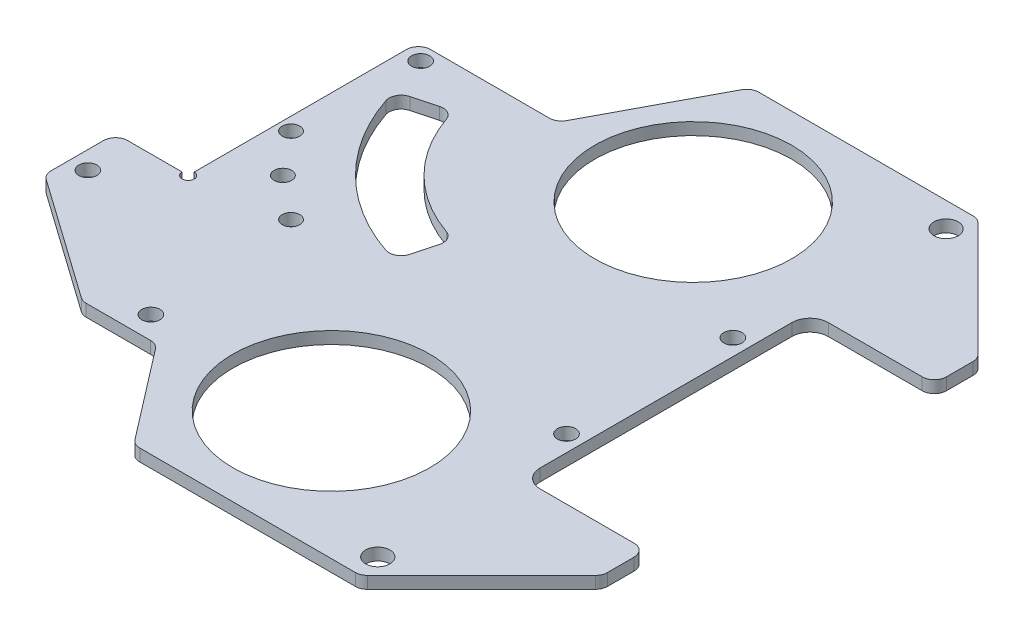
from build123d import *

# Parameters (mm, degrees)
SKETCH1_R           = 16.264719519
SKETCH1_R_2         = 1.5
SKETCH1_R_3         = 1.45
BOSS_EXTRUDE1_DEPTH = 2
SKETCH2_R           = 2
CUT_EXTRUDE1_DEPTH  = 119.16416129
FILLET1_R           = 2
SKETCH3_R           = 1
CUT_EXTRUDE2_DEPTH  = 10


with BuildPart() as part:
    # Sketch1 → Boss-Extrude1 (new body)
    with BuildSketch(Plane(origin=(0, 0, 0), x_dir=(1, 0, 0), z_dir=(0, 1, 0))):
        with BuildLine():
            Line((-12.392234006, -6.981301864), (-12.392234006, -30.758658484))
            Line((-12.392234006, -30.758658484), (-12.392234006, -37.869980174))
            Line((-12.392234006, -37.869980174), (-12.392234006, -39.662475092))
            ThreePointArc((-12.392234006, -39.662475092), (-11.513554349, -41.783795436), (-9.392234006, -42.662475092))
            Line((-9.392234006, -42.662475092), (8.128346254, -42.662475092))
            Line((8.128346254, -42.662475092), (8.128346254, -49.872480174))
            Line((8.128346254, -49.872480174), (-11.871653746, -69.872480174))
            Line((-11.871653746, -69.872480174), (-49.281653746, -69.872480174))
            Line((-49.281653746, -69.872480174), (-61.796944846, -53.596788721))
            Line((-61.796944846, -53.596788721), (-74.058017443, -53.596788721))
            Line((-74.058017443, -53.596788721), (-95.271220878, -38.596788721))
            Line((-95.271220878, -38.596788721), (-95.271220878, -26.897908721))
            Line((-95.271220878, -26.897908721), (-84.130114655, -26.897908721))
            Line((-84.130114655, -26.897908721), (-83.276622696, -26.897908721))
            Line((-83.276622696, -26.897908721), (-83.276622696, 11.130019826))
            Line((-83.276622696, 11.130019826), (-60.448477034, 11.130019826))
            Line((-60.448477034, 11.130019826), (-49.281653746, 32.132519826))
            Line((-49.281653746, 32.132519826), (-11.871653746, 32.132519826))
            Line((-11.871653746, 32.132519826), (8.128346254, 12.132519826))
            Line((8.128346254, 12.132519826), (8.128346254, 4.922514744))
            Line((8.128346254, 4.922514744), (-9.392234006, 4.922514744))
            ThreePointArc((-9.392234006, 4.922514744), (-11.513554349, 4.043835088), (-12.392234006, 1.922514744))
            Line((-12.392234006, 1.922514744), (-12.392234006, 0.130019826))
            Line((-12.392234006, 0.130019826), (-12.392234006, -6.981301864))
        make_face()
        with Locations(Location((-37.781653746, -48.747480173, 0), (0, 0, 270))):
            Circle(SKETCH1_R, mode=Mode.SUBTRACT)
        with Locations(Location((-37.781653746, 11.007519825, 0), (0, 0, 90))):
            Circle(SKETCH1_R, mode=Mode.SUBTRACT)
        with Locations(Location((-15.087114055, -5.127161907, 0), (0, 0, 270))):
            Circle(SKETCH1_R_2, mode=Mode.SUBTRACT)
        with Locations(Location((-15.087114055, -32.612798441, 0), (0, 0, 270))):
            Circle(SKETCH1_R_2, mode=Mode.SUBTRACT)
        with Locations(Location((-81.12792954, -12.064242343, 0), (0, 0, 270))):
            Circle(SKETCH1_R_3, mode=Mode.SUBTRACT)
        with Locations(Location((-75.470082252, -19.063439731, 0), (0, 0, 270))):
            Circle(SKETCH1_R_3, mode=Mode.SUBTRACT)
        with Locations(Location((-68.470884865, -24.721287018, 0), (0, 0, 270))):
            Circle(SKETCH1_R_3, mode=Mode.SUBTRACT)
        with Locations(Location((-92.311157954, -34.437864429, 0), (0, 0, 270))):
            Circle(SKETCH1_R_2, mode=Mode.SUBTRACT)
        with Locations(Location((-66.462987255, -49.872480174, 0), (0, 0, 270))):
            Circle(SKETCH1_R_2, mode=Mode.SUBTRACT)
        with Locations(Location((-80.455556672, 8.666951386, 0), (0, 0, 270))):
            Circle(SKETCH1_R_2, mode=Mode.SUBTRACT)
        with BuildLine():
            Line((-52.664953624, -16.00672876), (-53.702548501, -19.879085561))
            ThreePointArc((-53.702548501, -19.879085561), (-54.689042095, -21.123916801), (-56.271766971, -21.257169903))
            ThreePointArc((-56.271766971, -21.257169903), (-69.478161637, -13.071519115), (-77.663812425, 0.13487555))
            ThreePointArc((-77.663812425, 0.13487555), (-77.530559323, 1.717600427), (-76.285728083, 2.70409402))
            Line((-76.285728083, 2.70409402), (-72.413371282, 3.741688898))
            ThreePointArc((-72.413371282, 3.741688898), (-70.958270463, 3.576518776), (-70.005790184, 2.464142545))
            ThreePointArc((-70.005790184, 2.464142545), (-63.821307387, -7.414664865), (-53.942499976, -13.599147662))
            ThreePointArc((-53.942499976, -13.599147662), (-52.830123745, -14.551627941), (-52.664953624, -16.00672876))
        make_face(mode=Mode.SUBTRACT)
    extrude(amount=BOSS_EXTRUDE1_DEPTH)

    # Sketch2 → Cut-Extrude1 (cut, through all)
    with BuildSketch(Plane(origin=(0, 2, 0), x_dir=(1, 0, 0), z_dir=(0, 1, 0))):
        with Locations(Location((-13.067528443, -65.799136603, 0), (0, 0, 270))):
            Circle(SKETCH2_R)
        with Locations(Location((-13.067528443, 28.059176255, 0), (0, 0, 270))):
            Circle(SKETCH2_R)
    extrude(amount=-CUT_EXTRUDE1_DEPTH, mode=Mode.SUBTRACT)

    # Fillet1
    fillet1_edges = [part.edges().sort_by_distance(p)[0] for p in [
        (-49.281653746, 1, -32.132519826),
        (-11.871653746, 1, -32.132519826),
        (8.128346254, 1, -12.132519826),
        (8.128346254, 1, -4.922514744),
        (8.128346254, 1, 42.662475092),
        (8.128346254, 1, 49.872480174),
        (-11.871653746, 1, 69.872480174),
        (-49.281653746, 1, 69.872480174),
        (-61.796944846, 1, 53.596788721),
        (-74.058017443, 1, 53.596788721),
        (-95.271220878, 1, 38.596788721),
        (-95.271220878, 1, 26.897908721),
        (-83.276622696, 1, -11.130019826),
        (-60.448477034, 1, -11.130019826),
    ]]
    fillet(fillet1_edges, radius=FILLET1_R)

    # Sketch3 → Cut-Extrude2 (cut)
    with BuildSketch(Plane(origin=(0, 2, 0), x_dir=(1, 0, 0), z_dir=(0, 1, 0))):
        with Locations((-83.276622696, -26.897908721)):
            Circle(SKETCH3_R)
    extrude(amount=-CUT_EXTRUDE2_DEPTH, mode=Mode.SUBTRACT)


solid = part.part
